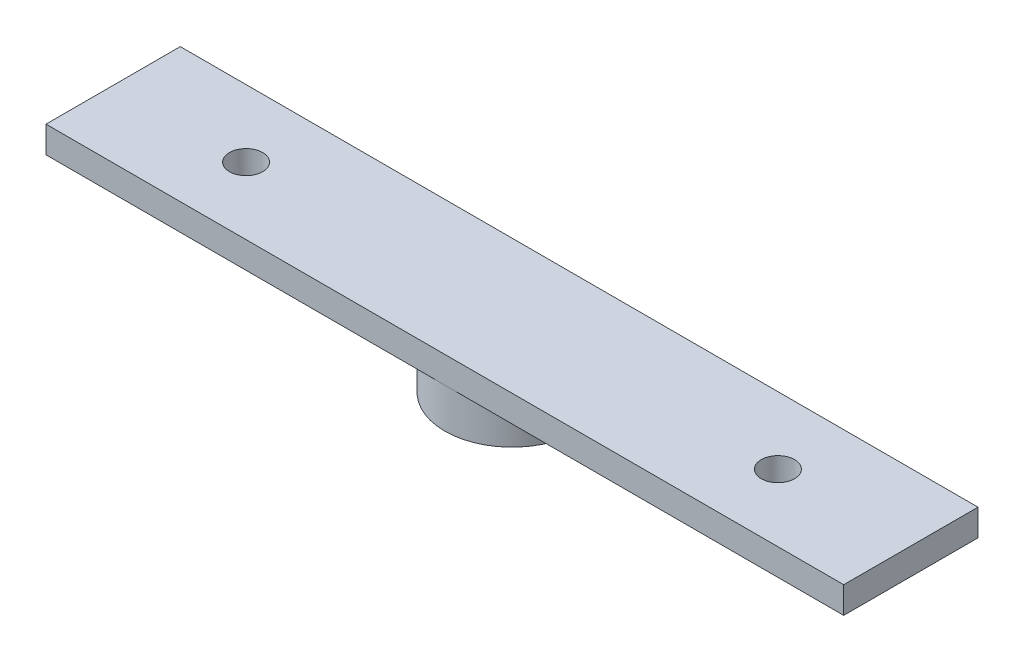
from build123d import *

# Parameters (mm, degrees)
SKETCH1_W           = 2
SKETCH1_H           = 3
SKETCH2_W           = 60
SKETCH2_H           = 10.1
BOSS_EXTRUDE1_DEPTH = 2
SKETCH3_R           = 1.25
CUT_EXTRUDE1_DEPTH  = 5


with BuildPart() as part:
    # Sketch1 → Revolve1 (revolve)
    with BuildSketch(Plane.XY, mode=Mode.PRIVATE) as revolve1_sk:
        with Locations((4.05, 1.5)):
            Rectangle(SKETCH1_W, SKETCH1_H)
    revolve(revolve1_sk.sketch.rotate(Axis((0, 97.022326023, 0), (0, -1, 0)), 90), axis=Axis((0, 97.022326023, 0), (0, -1, 0)))

    # Sketch2 → Boss-Extrude1 (add)
    with BuildSketch(Plane(origin=(0, 3, 0), x_dir=(1, 0, 0), z_dir=(0, 1, 0))):
        Rectangle(SKETCH2_W, SKETCH2_H)
    extrude(amount=BOSS_EXTRUDE1_DEPTH)

    # Sketch3 → Cut-Extrude1 (cut)
    with BuildSketch(Plane(origin=(0, 5, 0), x_dir=(1, 0, 0), z_dir=(0, 1, 0))):
        with Locations(Location((-20, 0, 0), (0, 0, 270))):
            Circle(SKETCH3_R)
        with Locations(Location((20, 0, 0), (0, 0, 90))):
            Circle(SKETCH3_R)
    extrude(amount=-CUT_EXTRUDE1_DEPTH, mode=Mode.SUBTRACT)


solid = part.part
